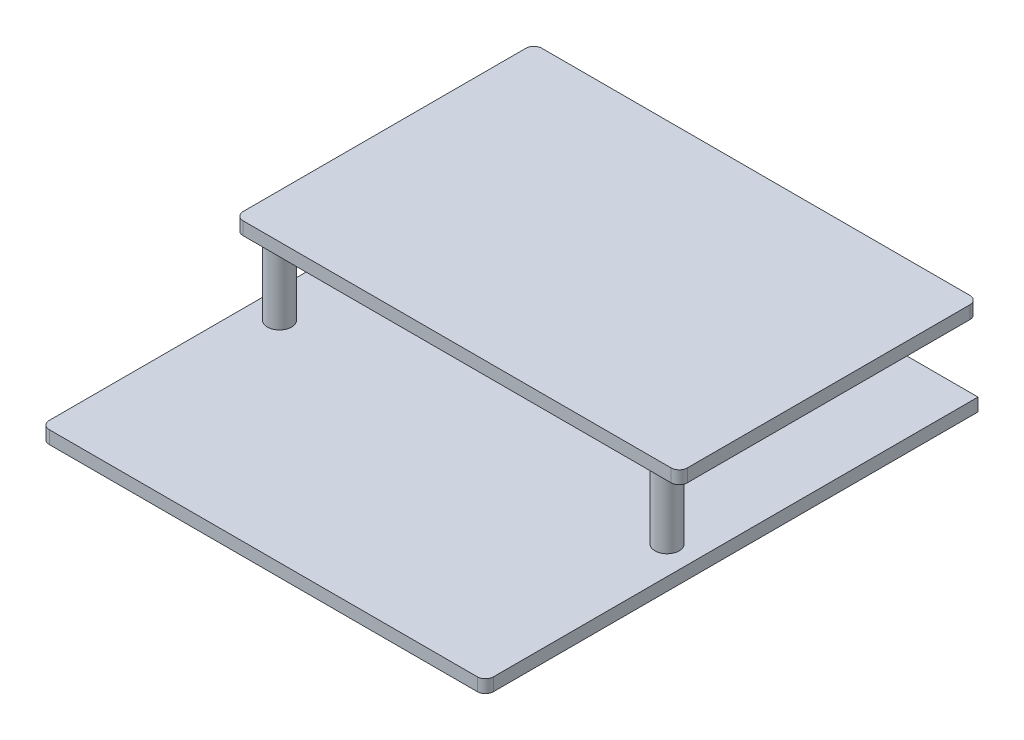
from build123d import *

# Parameters (mm, degrees)
SKETCH1_W           = 55
SKETCH1_H           = 61
BOSS_EXTRUDE1_DEPTH = 1.6
SKETCH2_R           = 1.5
BOSS_EXTRUDE2_DEPTH = 8.8
SKETCH3_W           = 55
SKETCH3_H           = 37
BOSS_EXTRUDE3_DEPTH = 1.6
FILLET1_R           = 1


with BuildPart() as part:
    # Sketch1 → Boss-Extrude1 (new body)
    with BuildSketch(Plane(origin=(0, 0, 0), x_dir=(1, 0, 0), z_dir=(0, 1, 0))):
        Rectangle(SKETCH1_W, SKETCH1_H)
    extrude(amount=BOSS_EXTRUDE1_DEPTH)

    # Sketch2 → Boss-Extrude2 (add)
    with BuildSketch(Plane(origin=(0, 1.6, 0), x_dir=(1, 0, 0), z_dir=(0, 1, 0))):
        with Locations(Location((-24, -4.5, 0), (0, 0, 270))):
            Circle(SKETCH2_R)
        with Locations(Location((24, -4.5, 0), (0, 0, 270))):
            Circle(SKETCH2_R)
    extrude(amount=BOSS_EXTRUDE2_DEPTH)

    # Sketch3 → Boss-Extrude3 (add)
    with BuildSketch(Plane(origin=(0, 10.4, 0), x_dir=(1, 0, 0), z_dir=(0, 1, 0))):
        with Locations((0, 12)):
            Rectangle(SKETCH3_W, SKETCH3_H)
    extrude(amount=BOSS_EXTRUDE3_DEPTH)

    # Fillet1
    fillet1_edges = [part.edges().sort_by_distance(p)[0] for p in [
        (-27.5, 11.2, -30.5),
        (-27.5, 11.2, 6.5),
        (27.5, 11.2, 6.5),
        (27.5, 11.2, -30.5),
        (-27.5, 0.8, -30.5),
        (27.5, 0.8, 30.5),
        (-27.5, 0.8, 30.5),
    ]]
    fillet(fillet1_edges, radius=FILLET1_R)


solid = part.part
